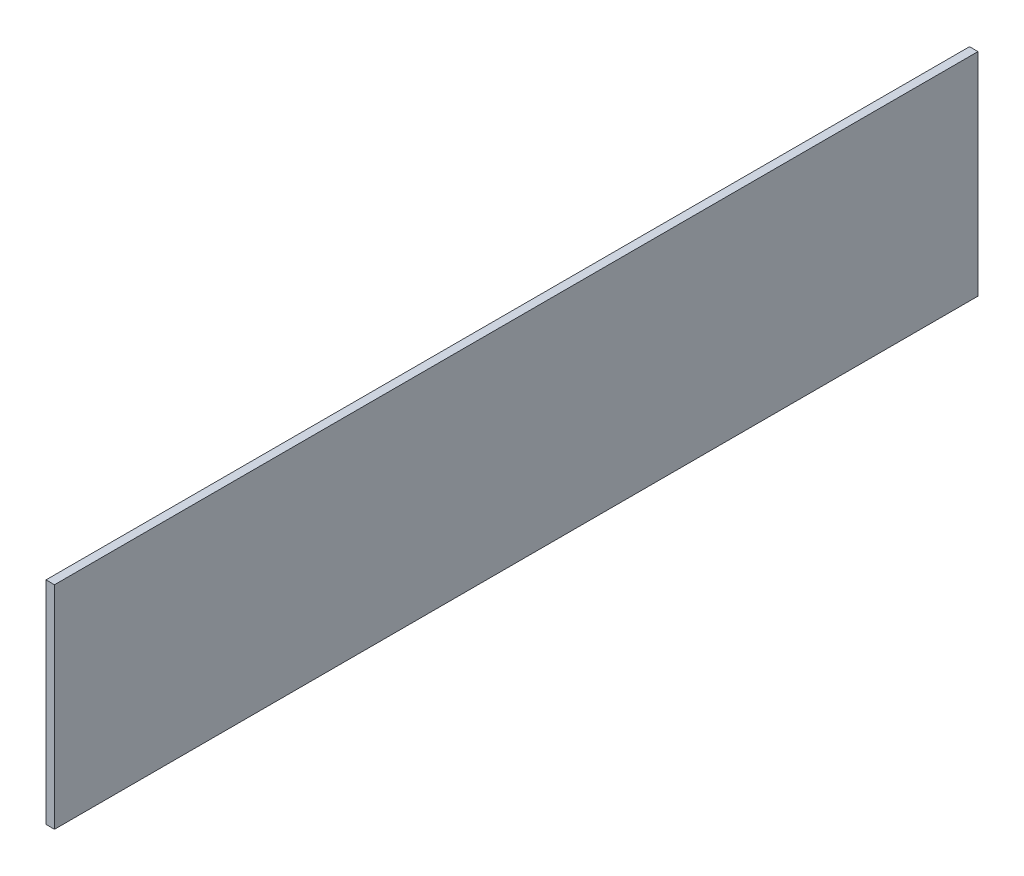
from build123d import *

# Parameters (mm, degrees)
SKETCH1_W           = 218
SKETCH1_H           = 50
BOSS_EXTRUDE1_DEPTH = 1


with BuildPart() as part:
    # Sketch1 → Boss-Extrude1 (new, symmetric)
    with BuildSketch(Plane(origin=(0, 0, 0), x_dir=(0, 0, -1), z_dir=(1, 0, 0))):
        with Locations((0, 25)):
            Rectangle(SKETCH1_W, SKETCH1_H)
    extrude(amount=BOSS_EXTRUDE1_DEPTH, both=True)


solid = part.part
